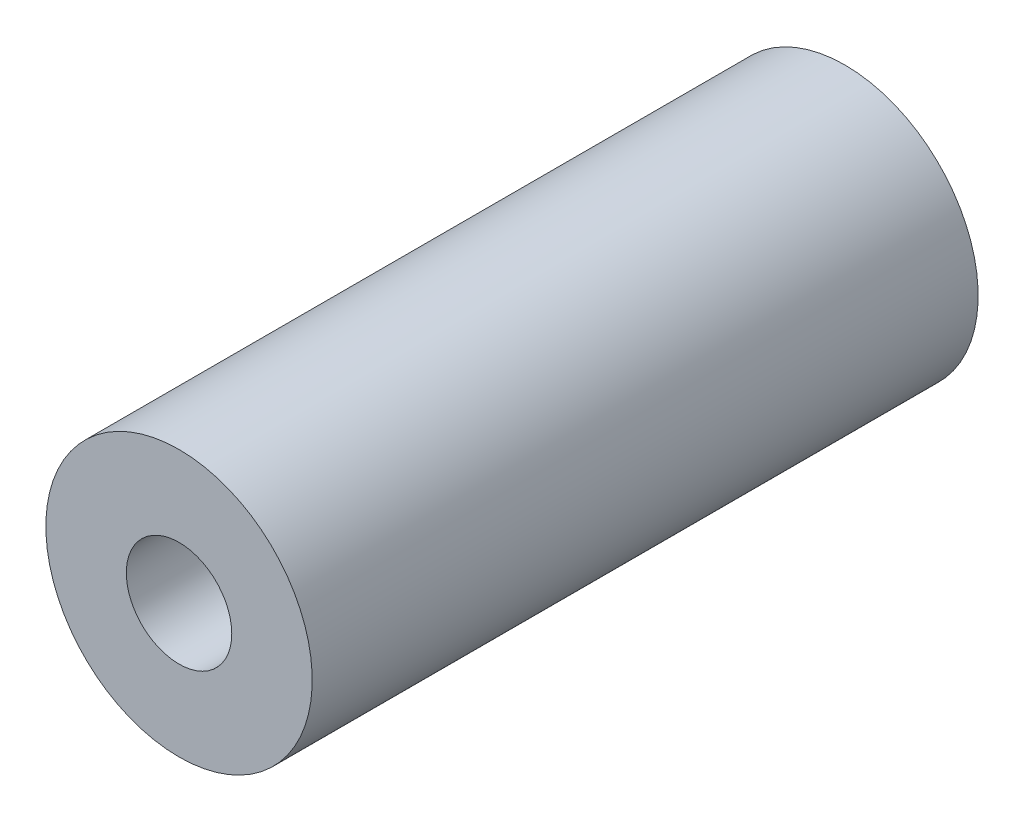
from build123d import *
from build123d.topology import SkipClean

# Parameters (mm, degrees)
ESQUISSE1_W             = 30
ESQUISSE1_H             = 6
ENL_V_MAT_EXTRU_4_DEPTH = 7.5
ENL_V_MAT_EXTRU_5_DEPTH = 15
ESQUISSE3_R             = 4.5
ENL_V_MAT_EXTRU_6_DEPTH = 10
ENL_V_MAT_EXTRU_9_DEPTH = 5


with BuildPart() as part:
    # Esquisse1 → Révolution1 (revolve)
    with BuildSketch(Plane(origin=(0, 0, 0), x_dir=(0, 0, -1), z_dir=(1, 0, 0)), mode=Mode.PRIVATE) as r_volution1_sk:
        with Locations((15, -3)):
            Rectangle(ESQUISSE1_W, ESQUISSE1_H)
    revolve(r_volution1_sk.sketch.rotate(Axis((0, 0, -30), (0, 0, 1)), 180), axis=Axis((0, 0, -30), (0, 0, 1)))

    # Esquisse2 → Enlèv. mat.-Extru.4 (cut)
    with BuildSketch(Plane.XY):
        with BuildLine():
            Line((-1.841364983, 1.5), (0, 1.5))
            Line((0, 1.5), (1.841364983, 1.5))
            ThreePointArc((1.841364983, 1.5), (0, 2.375), (-1.841364983, 1.5))
        make_face()
    extrude(amount=-ENL_V_MAT_EXTRU_4_DEPTH, mode=Mode.SUBTRACT)

    # Esquisse5 → Enlèv. mat.-Extru.5 (cut)
    with SkipClean():  # the faces are left unmerged after this step: merging them gives an invalid solid
        with BuildSketch(Plane.XY):
            with BuildLine():
                Line((-1.841364983, 1.5), (1.841364983, 1.5))
                ThreePointArc((1.841364983, 1.5), (0, -2.375), (-1.841364983, 1.5))
            make_face()
        extrude(amount=-ENL_V_MAT_EXTRU_5_DEPTH, mode=Mode.SUBTRACT)

    # Esquisse3 → Enlèv. mat.-Extru.6 (cut)
    with SkipClean():  # the faces are left unmerged after this step: merging them gives an invalid solid
        with BuildSketch(Plane(origin=(0, 0, -30), x_dir=(-1, 0, 0), z_dir=(0, 0, -1))):
            with Locations(Location((0, 0, 0), (0, 0, 90))):
                Circle(ESQUISSE3_R)
        extrude(amount=-ENL_V_MAT_EXTRU_6_DEPTH, mode=Mode.SUBTRACT)

    # Esquisse7 → Enlèv. mat.-Extru.9 (cut)
    with SkipClean():  # the faces are left unmerged after this step: merging them gives an invalid solid
        with BuildSketch(Plane(origin=(0, 0, -20), x_dir=(-1, 0, 0), z_dir=(0, 0, -1))):
            with BuildLine():
                Line((0, 2.5), (3.741657387, 2.5))
                ThreePointArc((3.741657387, 2.5), (0, -4.5), (-3.741657387, 2.5))
                Line((-3.741657387, 2.5), (0, 2.5))
            make_face()
        extrude(amount=-ENL_V_MAT_EXTRU_9_DEPTH, mode=Mode.SUBTRACT)


solid = part.part
